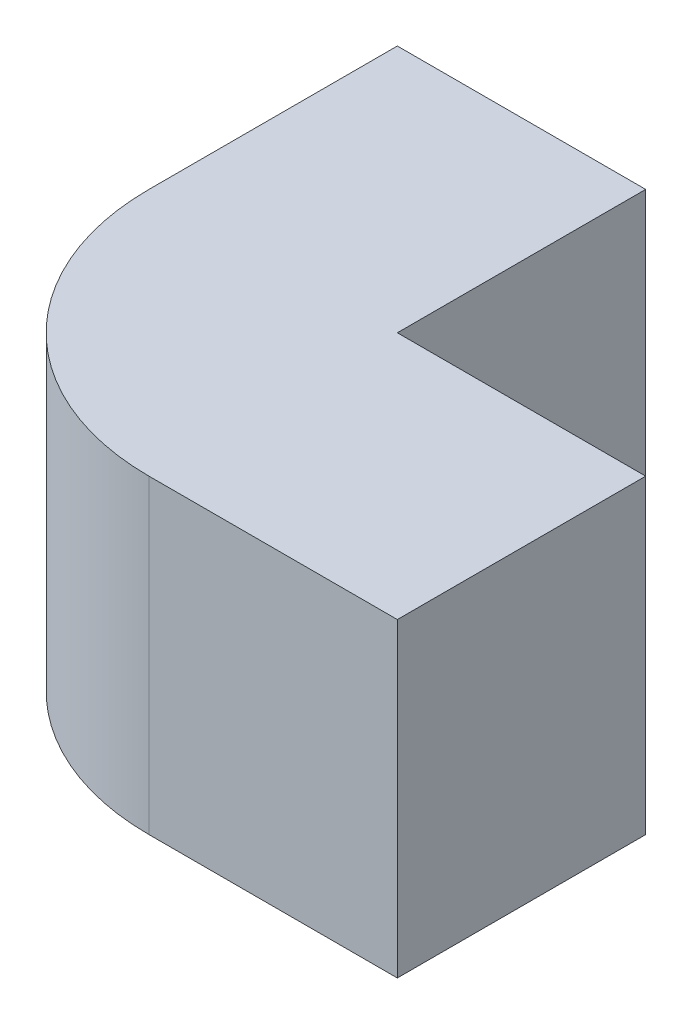
from build123d import *

# Parameters (mm, degrees)
SKETCH_1_W      = 4
SKETCH_1_H      = 5
EXTRUDE_1_DEPTH = 8
SKETCH_2_W      = 4
SKETCH_2_H      = 5
EXTRUDE_2_DEPTH = 4
FILLET_2_R      = 4


with BuildPart() as part:
    # 草图1 → 凸台-拉伸1 (new body)
    with BuildSketch(Plane.XY):
        with Locations((2, -2.5)):
            Rectangle(SKETCH_1_W, SKETCH_1_H)
    extrude(amount=EXTRUDE_1_DEPTH)

    # 草图2 → 凸台-拉伸2 (add)
    with BuildSketch(Plane(origin=(4, 0, 0), x_dir=(0, 0, -1), z_dir=(1, 0, 0))):
        with Locations((-6, -2.5)):
            Rectangle(SKETCH_2_W, SKETCH_2_H)
    extrude(amount=EXTRUDE_2_DEPTH)

    # 圆角2
    fillet_2_edges = [part.edges().sort_by_distance(p)[0] for p in [
        (0, -2.5, 8),
    ]]
    fillet(fillet_2_edges, radius=FILLET_2_R)


solid = part.part
